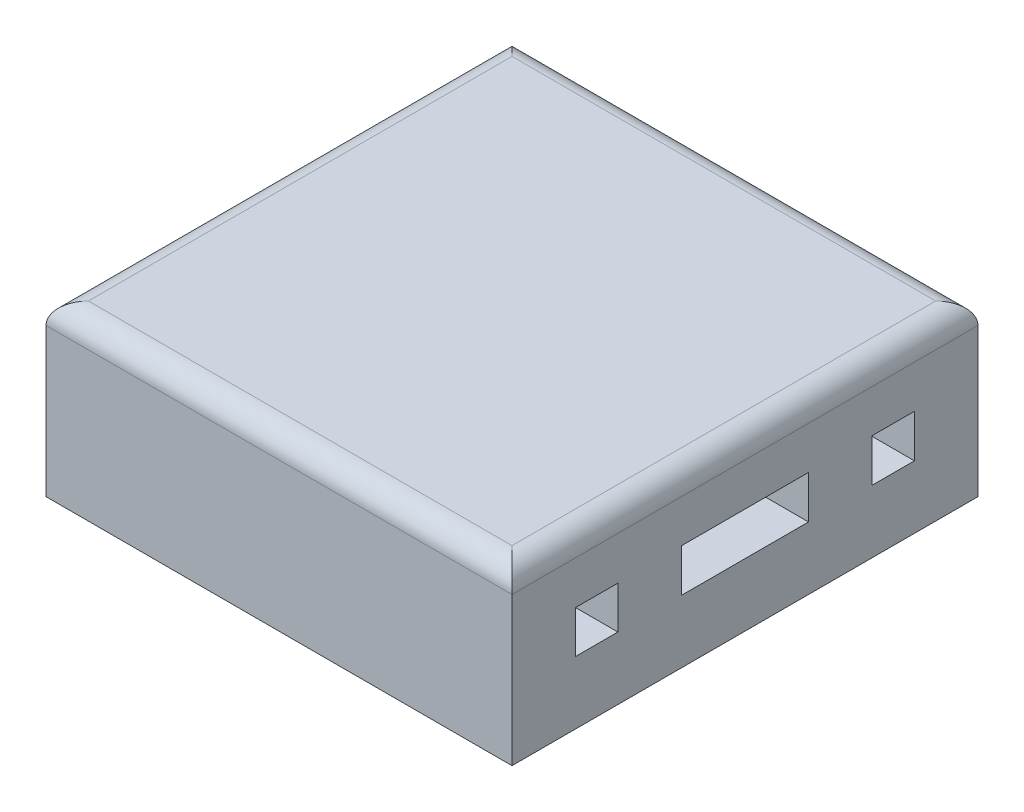
from build123d import *

# Parameters (mm, degrees)
SKETCH2_W               = 11
SKETCH2_H               = 11
BOSS_EXTRUDE1_DEPTH     = 4
CUT_EXTRUDE2_DEPTH      = 9.746427842
CUT_EXTRUDE2_DEPTH_BACK = 9.746427842
SKETCH4_W               = 1
SKETCH4_H               = 1
SKETCH4_W_2             = 3
SKETCH4_H_2             = 1.012866832
CUT_EXTRUDE3_DEPTH      = 2.5
CUT_EXTRUDE3_DEPTH_BACK = 9.746427842
SKETCH5_R               = 2.25
SKETCH8_R               = 1
CUT_EXTRUDE4_DEPTH      = 1
SKETCH8_3_R             = 1
CUT_EXTRUDE5_DEPTH      = 0.55
FILLET2_R               = 0.5


with BuildPart() as part:
    # Sketch2 → Boss-Extrude1 (new body)
    with BuildSketch(Plane(origin=(0, 0, 0), x_dir=(1, 0, 0), z_dir=(0, 1, 0))):
        Rectangle(SKETCH2_W, SKETCH2_H)
    extrude(amount=BOSS_EXTRUDE1_DEPTH)

    # Sketch4 → Cut-Extrude2 (cut, two sides: drawn at the far end of the back side and taken through both)
    with BuildSketch(Plane(origin=(0, 0, 0), x_dir=(0, 0, -1), z_dir=(1, 0, 0)).offset(-CUT_EXTRUDE2_DEPTH_BACK)):
        with Locations((-3.5, 1.982791405)):
            Rectangle(SKETCH4_W, SKETCH4_H)
        with Locations((0, 1.989224821)):
            Rectangle(SKETCH4_W_2, SKETCH4_H_2)
        with Locations((3.5, 1.989224821)):
            Rectangle(SKETCH4_W, SKETCH4_H_2)
    extrude(amount=CUT_EXTRUDE2_DEPTH + CUT_EXTRUDE2_DEPTH_BACK, mode=Mode.SUBTRACT)

    # Sketch5 → Cut-Extrude3 (cut, two sides: drawn at the far end of the back side and taken through both)
    with BuildSketch(Plane(origin=(0, 0, 0), x_dir=(1, 0, 0), z_dir=(0, 1, 0)).offset(-CUT_EXTRUDE3_DEPTH_BACK)):
        Circle(SKETCH5_R)
    extrude(amount=CUT_EXTRUDE3_DEPTH + CUT_EXTRUDE3_DEPTH_BACK, mode=Mode.SUBTRACT)

    # Sketch8 → Cut-Extrude4 (cut)
    with BuildSketch(Plane(origin=(0, 0, 0), x_dir=(1, 0, 0), z_dir=(0, 1, 0))):
        with Locations((0, -4)):
            Circle(SKETCH8_R)
    extrude(amount=CUT_EXTRUDE4_DEPTH, mode=Mode.SUBTRACT)

    # Sketch8<3> → Cut-Extrude5 (cut)
    with BuildSketch(Plane(origin=(0, 0, 0), x_dir=(1, 0, 0), z_dir=(0, 1, 0))):
        with Locations((0, 4)):
            Circle(SKETCH8_3_R)
    extrude(amount=CUT_EXTRUDE5_DEPTH, mode=Mode.SUBTRACT)

    # Fillet2
    fillet2_edges = [part.edges().sort_by_distance(p)[0] for p in [
        (0, 4, 5.5),
        (-5.5, 4, 0),
        (0, 4, -5.5),
        (5.5, 4, 0),
    ]]
    fillet(fillet2_edges, radius=FILLET2_R)


solid = part.part
